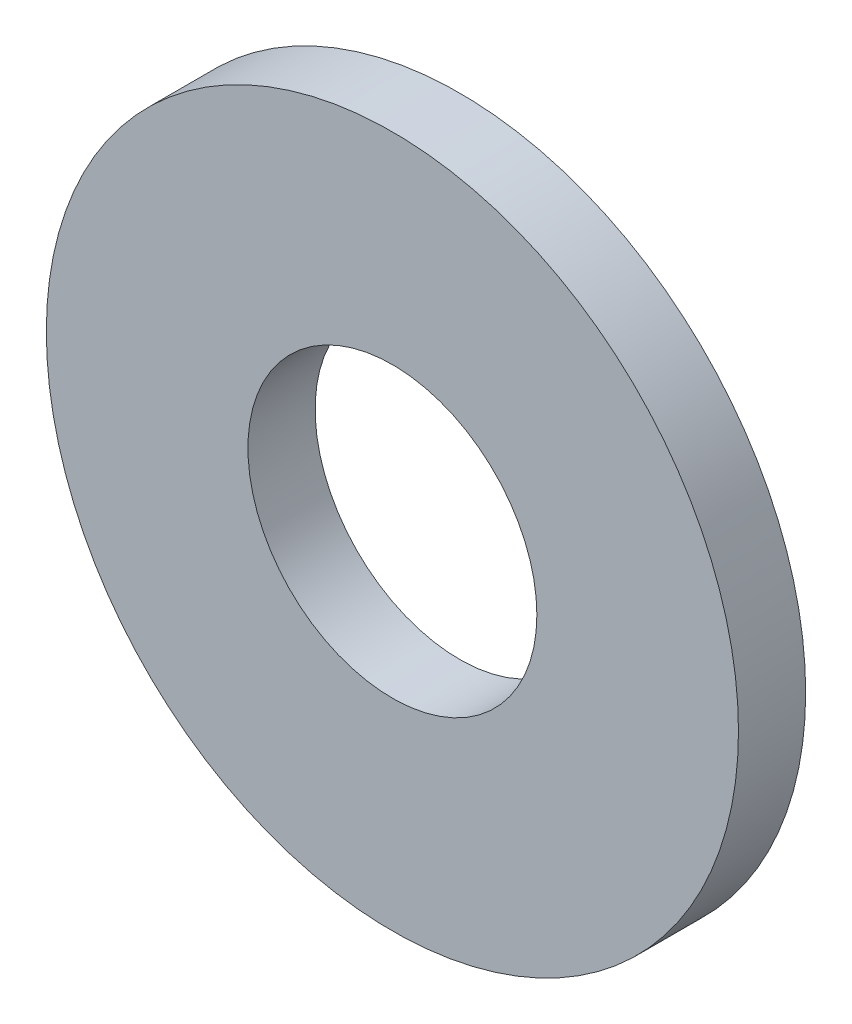
from build123d import *

# Parameters (mm, degrees)
ESBO_O1_R                = 5.15
ESBO_O1_R_2              = 2.15
RESSALTO_EXTRUS_O1_DEPTH = 1


with BuildPart() as part:
    # Esboço1 → Ressalto-extrusão1 (new body)
    with BuildSketch(Plane.XY):
        Circle(ESBO_O1_R)
        Circle(ESBO_O1_R_2, mode=Mode.SUBTRACT)
    extrude(amount=RESSALTO_EXTRUS_O1_DEPTH)


solid = part.part
